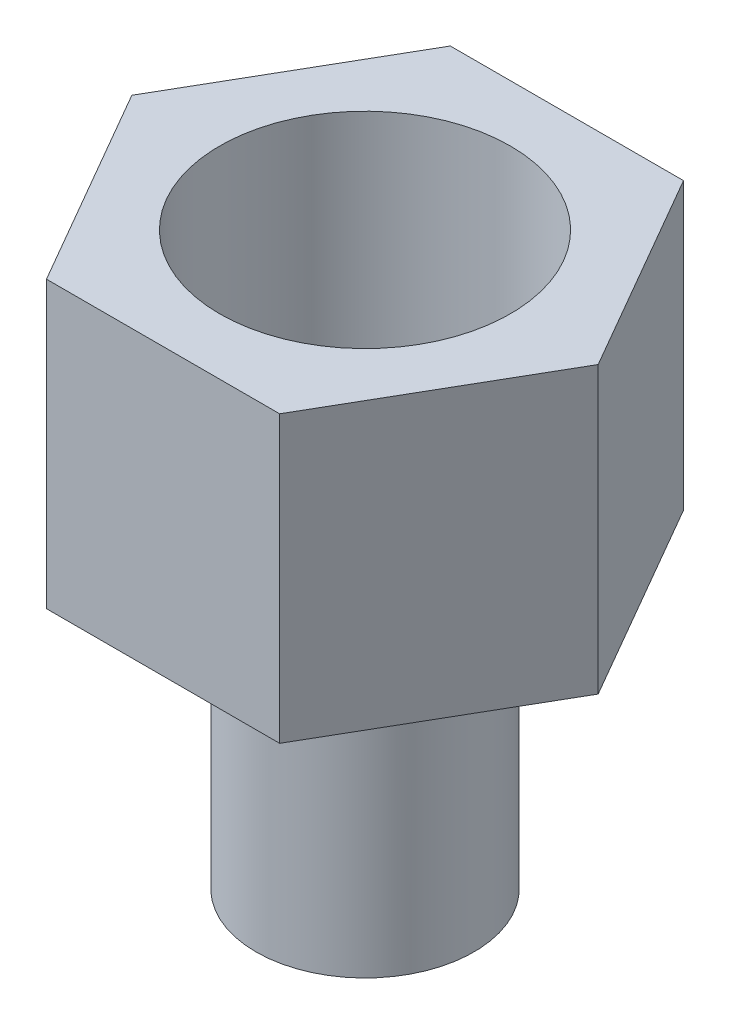
from build123d import *

# Parameters (mm, degrees)
BOSS_EXTRUDE1_DEPTH = 13.462
SKETCH2_R           = 6.858
CUT_EXTRUDE1_DEPTH  = 12.954
SKETCH3_R           = 5.1435
BOSS_EXTRUDE2_DEPTH = 13.462
SKETCH4_R           = 2.794
CUT_EXTRUDE2_DEPTH  = 31.603838011


with BuildPart() as part:
    # Sketch1 → Boss-Extrude1 (new body)
    with BuildSketch(Plane(origin=(0, 0, 0), x_dir=(1, 0, 0), z_dir=(0, 1, 0))):
        Polygon((5.499261314, 9.525), (-5.499261314, 9.525), (-10.998522628, 0), (-5.499261314, -9.525), (5.499261314, -9.525), (10.998522628, 0), align=None)
    extrude(amount=-BOSS_EXTRUDE1_DEPTH)

    # Sketch2 → Cut-Extrude1 (cut)
    with BuildSketch(Plane(origin=(0, 0, 0), x_dir=(1, 0, 0), z_dir=(0, 1, 0))):
        with Locations(Location((0, 0, 0), (0, 0, 270))):
            Circle(SKETCH2_R)
    extrude(amount=-CUT_EXTRUDE1_DEPTH, mode=Mode.SUBTRACT)

    # Sketch3 → Boss-Extrude2 (add)
    with BuildSketch(Plane.XZ.offset(13.462)):
        with Locations(Location((0, 0, 0), (0, 0, 90))):
            Circle(SKETCH3_R)
    extrude(amount=BOSS_EXTRUDE2_DEPTH)

    # Sketch4 → Cut-Extrude2 (cut, through all)
    with BuildSketch(Plane.XZ.offset(26.924)):
        with Locations(Location((0, 0, 0), (0, 0, 270))):
            Circle(SKETCH4_R)
    extrude(amount=-CUT_EXTRUDE2_DEPTH, mode=Mode.SUBTRACT)


solid = part.part
